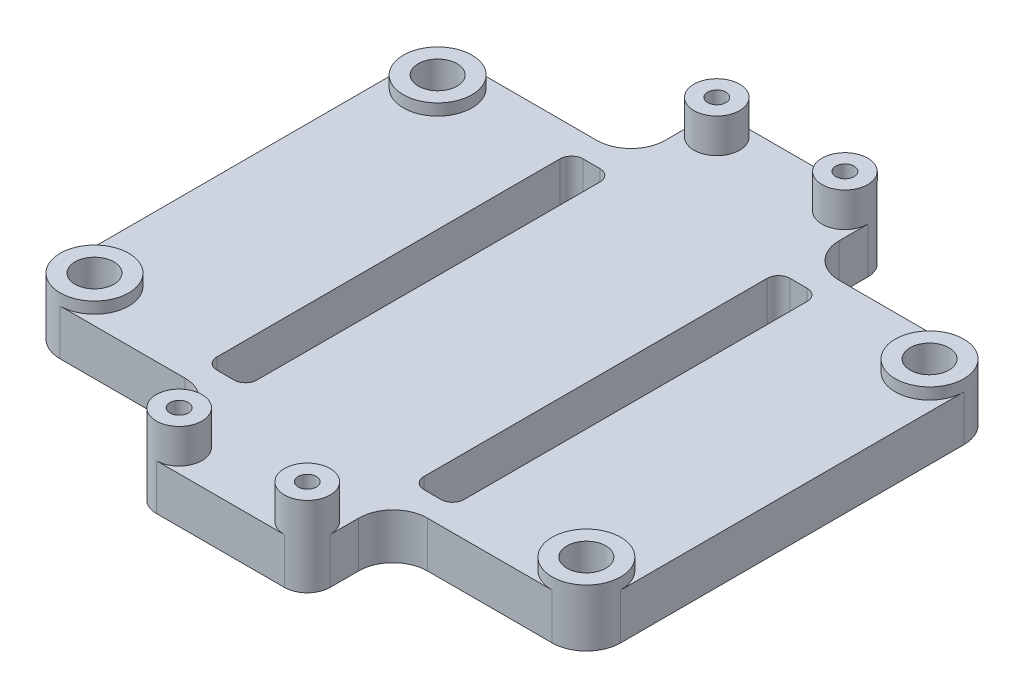
from build123d import *

# Parameters (mm, degrees)
SKETCH1_R               = 3
SKETCH1_R_2             = 1.7
BOSS_EXTRUDE1_DEPTH     = 5
BOSS_EXTRUDE1_2_DEPTH   = 5
BOSS_EXTRUDE1_3_DEPTH   = 5
BOSS_EXTRUDE1_4_DEPTH   = 5
BOSS_EXTRUDE2_DEPTH     = 4
CUT_EXTRUDE1_DEPTH      = 31.809901006
CUT_EXTRUDE1_DEPTH_BACK = 31.809901006
SKETCH1_2_R             = 1.7
SKETCH3_R               = 2
SKETCH3_R_2             = 0.8
BOSS_EXTRUDE3_DEPTH     = 7
BOSS_EXTRUDE3_2_DEPTH   = 7
BOSS_EXTRUDE3_3_DEPTH   = 7
BOSS_EXTRUDE3_4_DEPTH   = 7
BOSS_EXTRUDE4_DEPTH     = 4
CUT_EXTRUDE2_DEPTH      = 36.587919299
CUT_EXTRUDE2_DEPTH_BACK = 36.587919299
SKETCH6_W               = 3.5
SKETCH6_H               = 32
FILLET1_R               = 1
FILLET2_R               = 3


with BuildPart() as part:
    # Sketch1 → Boss-Extrude1 (new body)
    with BuildSketch(Plane(origin=(0, 0, 0), x_dir=(1, 0, 0), z_dir=(0, 1, 0))):
        with Locations(Location((-21.5, 15, 0), (0, 0, 270))):
            Circle(SKETCH1_R)
        with Locations(Location((-21.5, 15, 0), (0, 0, 270))):
            Circle(SKETCH1_R_2, mode=Mode.SUBTRACT)
    extrude(amount=BOSS_EXTRUDE1_DEPTH)



with BuildPart() as body_2:
    # Sketch1 → Boss-Extrude1 2 (new body)
    with BuildSketch(Plane(origin=(0, 0, 0), x_dir=(1, 0, 0), z_dir=(0, 1, 0))):
        with Locations(Location((-21.5, -15, 0), (0, 0, 270))):
            Circle(SKETCH1_R)
        with Locations(Location((-21.5, -15, 0), (0, 0, 270))):
            Circle(SKETCH1_R_2, mode=Mode.SUBTRACT)
    extrude(amount=BOSS_EXTRUDE1_2_DEPTH)


with BuildPart() as body_3:
    # Sketch1 → Boss-Extrude1 3 (new body)
    with BuildSketch(Plane(origin=(0, 0, 0), x_dir=(1, 0, 0), z_dir=(0, 1, 0))):
        with Locations(Location((21.5, -15, 0), (0, 0, 270))):
            Circle(SKETCH1_R)
        with Locations(Location((21.5, -15, 0), (0, 0, 270))):
            Circle(SKETCH1_R_2, mode=Mode.SUBTRACT)
    extrude(amount=BOSS_EXTRUDE1_3_DEPTH)


with BuildPart() as body_4:
    # Sketch1 → Boss-Extrude1 4 (new body)
    with BuildSketch(Plane(origin=(0, 0, 0), x_dir=(1, 0, 0), z_dir=(0, 1, 0))):
        with Locations(Location((21.5, 15, 0), (0, 0, 270))):
            Circle(SKETCH1_R)
        with Locations(Location((21.5, 15, 0), (0, 0, 270))):
            Circle(SKETCH1_R_2, mode=Mode.SUBTRACT)
    extrude(amount=BOSS_EXTRUDE1_4_DEPTH)


with BuildPart() as part_1:
    add(part.part)

    add(body_2.part)  # Boss-Extrude2 merges body 2

    add(body_3.part)  # Boss-Extrude2 merges body 3

    add(body_4.part)  # Boss-Extrude2 merges body 4
    # Sketch2 → Boss-Extrude2 (add)
    with BuildSketch(Plane(origin=(0, 0, 0), x_dir=(1, 0, 0), z_dir=(0, 1, 0))):
        with BuildLine():
            Line((-21.5, -18), (21.5, -18))
            ThreePointArc((21.5, -18), (23.621320344, -17.121320344), (24.5, -15))
            Line((24.5, -15), (24.5, 15))
            ThreePointArc((24.5, 15), (23.621320344, 17.121320344), (21.5, 18))
            Line((21.5, 18), (-21.5, 18))
            ThreePointArc((-21.5, 18), (-23.621320344, 17.121320344), (-24.5, 15))
            Line((-24.5, 15), (-24.5, -15))
            ThreePointArc((-24.5, -15), (-23.621320344, -17.121320344), (-21.5, -18))
        make_face()
    extrude(amount=BOSS_EXTRUDE2_DEPTH)

    # Sketch1<2> → Cut-Extrude1 (cut, two sides: drawn at the far end of the back side and taken through both)
    with BuildSketch(Plane(origin=(0, 0, 0), x_dir=(1, 0, 0), z_dir=(0, 1, 0)).offset(-CUT_EXTRUDE1_DEPTH_BACK)):
        with Locations(Location((-21.5, -15, 0), (0, 0, 270))):
            Circle(SKETCH1_2_R)
        with Locations(Location((-21.5, 15, 0), (0, 0, 270))):
            Circle(SKETCH1_2_R)
        with Locations(Location((21.5, 15, 0), (0, 0, 270))):
            Circle(SKETCH1_2_R)
        with Locations(Location((21.5, -15, 0), (0, 0, 270))):
            Circle(SKETCH1_2_R)
    extrude(amount=CUT_EXTRUDE1_DEPTH + CUT_EXTRUDE1_DEPTH_BACK, mode=Mode.SUBTRACT)



with BuildPart() as body_2_2:
    # Sketch3 → Boss-Extrude3 (new body)
    with BuildSketch(Plane(origin=(0, 0, 0), x_dir=(1, 0, 0), z_dir=(0, 1, 0))):
        with Locations(Location((-5.6, 23.5, 0), (0, 0, 270))):
            Circle(SKETCH3_R)
        with Locations(Location((-5.6, 23.5, 0), (0, 0, 270))):
            Circle(SKETCH3_R_2, mode=Mode.SUBTRACT)
    extrude(amount=BOSS_EXTRUDE3_DEPTH)


with BuildPart() as body_3_2:
    # Sketch3 → Boss-Extrude3 2 (new body)
    with BuildSketch(Plane(origin=(0, 0, 0), x_dir=(1, 0, 0), z_dir=(0, 1, 0))):
        with Locations(Location((5.6, 23.5, 0), (0, 0, 270))):
            Circle(SKETCH3_R)
        with Locations(Location((5.6, 23.5, 0), (0, 0, 270))):
            Circle(SKETCH3_R_2, mode=Mode.SUBTRACT)
    extrude(amount=BOSS_EXTRUDE3_2_DEPTH)


with BuildPart() as body_4_2:
    # Sketch3 → Boss-Extrude3 3 (new body)
    with BuildSketch(Plane(origin=(0, 0, 0), x_dir=(1, 0, 0), z_dir=(0, 1, 0))):
        with Locations(Location((-5.6, -23.5, 0), (0, 0, 270))):
            Circle(SKETCH3_R)
        with Locations(Location((-5.6, -23.5, 0), (0, 0, 270))):
            Circle(SKETCH3_R_2, mode=Mode.SUBTRACT)
    extrude(amount=BOSS_EXTRUDE3_3_DEPTH)


with BuildPart() as body_5:
    # Sketch3 → Boss-Extrude3 4 (new body)
    with BuildSketch(Plane(origin=(0, 0, 0), x_dir=(1, 0, 0), z_dir=(0, 1, 0))):
        with Locations(Location((5.6, -23.5, 0), (0, 0, 270))):
            Circle(SKETCH3_R)
        with Locations(Location((5.6, -23.5, 0), (0, 0, 270))):
            Circle(SKETCH3_R_2, mode=Mode.SUBTRACT)
    extrude(amount=BOSS_EXTRUDE3_4_DEPTH)


with BuildPart() as part_2:
    add(part_1.part)

    add(body_2_2.part)  # Boss-Extrude4 merges body 2 2

    add(body_3_2.part)  # Boss-Extrude4 merges body 3 2

    add(body_4_2.part)  # Boss-Extrude4 merges body 4 2

    add(body_5.part)  # Boss-Extrude4 merges body 5
    # Sketch4 → Boss-Extrude4 (add)
    with BuildSketch(Plane(origin=(0, 4, 0), x_dir=(1, 0, 0), z_dir=(0, 1, 0))):
        with BuildLine():
            Line((-5.6, -25.5), (5.6, -25.5))
            ThreePointArc((5.6, -25.5), (7.014213562, -24.914213562), (7.6, -23.5))
            Line((7.6, -23.5), (7.6, 23.5))
            ThreePointArc((7.6, 23.5), (7.014213562, 24.914213562), (5.6, 25.5))
            Line((5.6, 25.5), (-5.6, 25.5))
            ThreePointArc((-5.6, 25.5), (-7.014213562, 24.914213562), (-7.6, 23.5))
            Line((-7.6, 23.5), (-7.6, -23.5))
            ThreePointArc((-7.6, -23.5), (-7.014213562, -24.914213562), (-5.6, -25.5))
        make_face()
    extrude(amount=-BOSS_EXTRUDE4_DEPTH)

    # Sketch6 → Cut-Extrude2 (cut, two sides: drawn at the far end of the back side and taken through both)
    with BuildSketch(Plane(origin=(0, 4, 0), x_dir=(1, 0, 0), z_dir=(0, 1, 0)).offset(-CUT_EXTRUDE2_DEPTH_BACK)):
        with Locations((-9.05, 0)):
            Rectangle(SKETCH6_W, SKETCH6_H)
        with Locations((9.05, 0)):
            Rectangle(SKETCH6_W, SKETCH6_H)
    extrude(amount=CUT_EXTRUDE2_DEPTH + CUT_EXTRUDE2_DEPTH_BACK, mode=Mode.SUBTRACT)

    # Fillet1
    fillet1_edges = [part_2.edges().sort_by_distance(p)[0] for p in [
        (-10.8, 2, 16),
        (-10.8, 2, -16),
        (-7.3, 2, -16),
        (-7.3, 2, 16),
        (10.8, 2, -16),
        (10.8, 2, 16),
        (7.3, 2, 16),
        (7.3, 2, -16),
    ]]
    fillet(fillet1_edges, radius=FILLET1_R)

    # Fillet2
    fillet2_edges = [part_2.edges().sort_by_distance(p)[0] for p in [
        (-7.6, 2, 18),
        (-7.6, 2, -18),
        (7.6, 2, 18),
        (7.6, 2, -18),
    ]]
    fillet(fillet2_edges, radius=FILLET2_R)


solid = part_2.part
